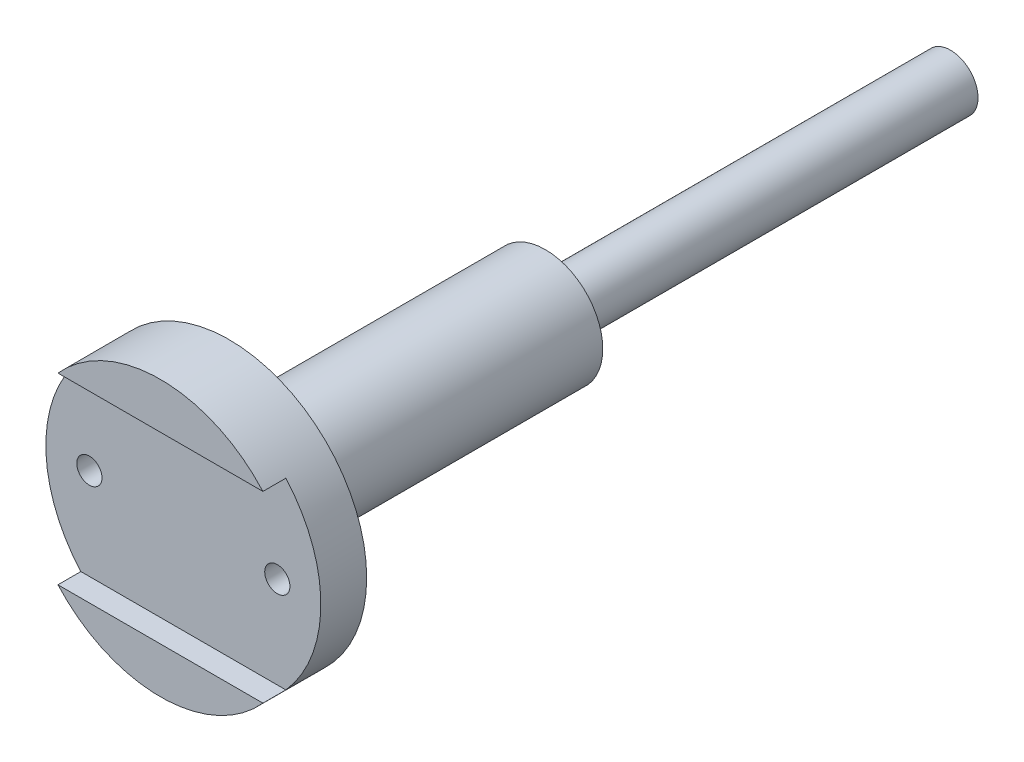
from build123d import *

# Parameters (mm, degrees)
ESQUISSE1_R                                = 30
BOSS_EXTRU_1_DEPTH                         = 15
ESQUISSE2_R                                = 12.5
BOSS_EXTRU_2_DEPTH                         = 69
ESQUISSE4_2_W                              = 230
ESQUISSE4_2_H                              = 40
ENL_V_MAT_EXTRU_1_DEPTH                    = 5
CHAMBRAGE_POUR_VIS_T_TE_HEXAGONALE_2_COUNT = 2
CHAMBRAGE_POUR_VIS_T_TE_HEXAGONALE_2_PITCH = 41
ESQUISSE17_R                               = 6
BOSS_EXTRU_4_DEPTH                         = 88.38
ESQUISSE18_W                               = 10.356322474
ESQUISSE18_H                               = 3
ENL_V_MAT_EXTRU_2_DEPTH                    = 3


with BuildPart() as part:
    # Esquisse1 → Boss.-Extru.1 (new body)
    with BuildSketch(Plane.XY):
        Circle(ESQUISSE1_R)
    extrude(amount=BOSS_EXTRU_1_DEPTH)

    # Esquisse2 → Boss.-Extru.2 (add)
    with BuildSketch(Plane(origin=(0, 0, 0), x_dir=(-1, 0, 0), z_dir=(0, 0, -1))):
        with Locations(Location((0, 0, 0), (0, 0, 180))):
            Circle(ESQUISSE2_R)
    extrude(amount=BOSS_EXTRU_2_DEPTH)

    # Esquisse4<2> → Enlèv. mat.-Extru.1 (cut)
    with BuildSketch(Plane.XY.offset(15)):
        Rectangle(ESQUISSE4_2_W, ESQUISSE4_2_H)
    extrude(amount=-ENL_V_MAT_EXTRU_1_DEPTH, mode=Mode.SUBTRACT)

    # Esquisse14 → Chambrage pour vis à tête hexagonale M51 (revolve, cut)
    with BuildSketch(Plane.YZ.offset(-20.5)):
        Polygon((0, 0), (0, 15), (2.75, 15), (2.75, 3.605), (2.775, 3.58), (6.12, 3.58), (6.12, 0), align=None)
    chambrage_pour_vis_t_te_hexagonale_m51 = revolve(axis=Axis((-20.5, 0, -6.35), (0, 0, 1)), mode=Mode.SUBTRACT)

    # Chambrage pour vis _ t_te hexagonale 2: Chambrage pour vis à tête hexagonale M51 ×2
    with Locations(*[(i * CHAMBRAGE_POUR_VIS_T_TE_HEXAGONALE_2_PITCH, 0, 0) for i in range(1, CHAMBRAGE_POUR_VIS_T_TE_HEXAGONALE_2_COUNT)]):
        add(chambrage_pour_vis_t_te_hexagonale_m51, mode=Mode.SUBTRACT)

    # Esquisse17 → Boss.-Extru.4 (add)
    with BuildSketch(Plane(origin=(0, 0, -69), x_dir=(-1, 0, 0), z_dir=(0, 0, -1))):
        Circle(ESQUISSE17_R)
    extrude(amount=BOSS_EXTRU_4_DEPTH)

    # Esquisse18 → Enlèv. mat.-Extru.2 (cut)
    with BuildSketch(Plane(origin=(0, 0, -157.38), x_dir=(-1, 0, 0), z_dir=(0, 0, -1))):
        with Locations((1.787207702, 0)):
            Rectangle(ESQUISSE18_W, ESQUISSE18_H)
    extrude(amount=-ENL_V_MAT_EXTRU_2_DEPTH, mode=Mode.SUBTRACT)


solid = part.part
